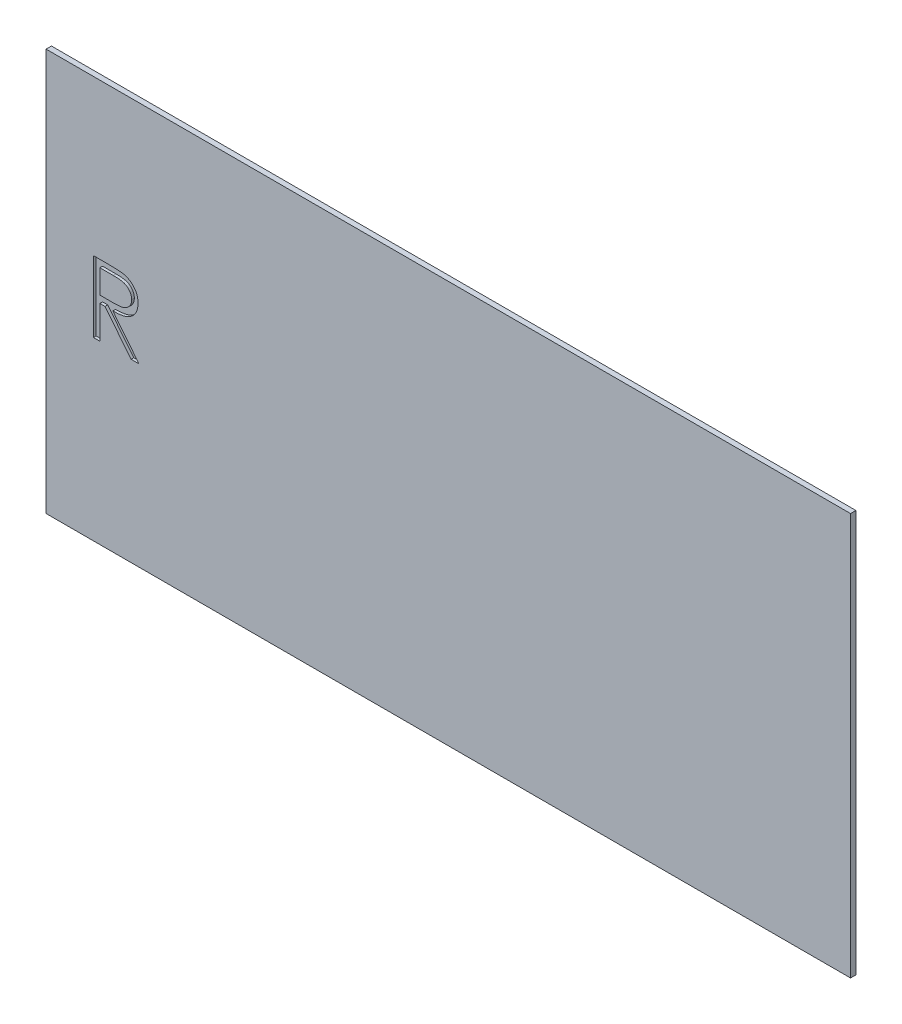
from build123d import *

# Parameters (mm, degrees)
SKETCH1_W           = 1500
SKETCH1_H           = 750
BOSS_EXTRUDE1_DEPTH = 10
CUT_EXTRUDE1_DEPTH  = 5


with BuildPart() as part:
    # Sketch1 → Boss-Extrude1 (new body)
    with BuildSketch(Plane.XY):
        with Locations((750, 375)):
            Rectangle(SKETCH1_W, SKETCH1_H)
    extrude(amount=BOSS_EXTRUDE1_DEPTH)

    # Sketch2 → Cut-Extrude1 (cut)
    with BuildSketch(Plane.XY.offset(10)):
        with BuildLine():
            Line((88.344425578, 460.647477035), (114.818659352, 460.647477035))
            add(Edge.make_bspline(
                [(114.818659352, 460.647477035), (116.585362721, 460.641596255), (119.977628894, 460.630304506), (124.837392387, 460.567342634), (129.253178494, 460.386883356), (133.222678373, 460.231588683), (136.745819201, 459.948411139), (139.833404297, 459.677755727), (142.471213102, 459.323453668), (144.068005696, 458.994409407), (144.790990081, 458.845427088)],
                knots=[0, 0, 0, 0, 1.410062039, 2.707475311, 3.878576406, 4.937260626, 5.877586885, 6.699081471, 7.410979367, 8, 8, 8, 8], degree=3))
            add(Edge.make_bspline(
                [(144.790990081, 458.845427088), (145.758859505, 458.606290421), (147.673951072, 458.133118521), (150.431289877, 457.133008609), (153.058765813, 455.975659702), (155.545464529, 454.616316702), (157.878930446, 453.044889018), (160.083223741, 451.288504629), (162.168346911, 449.356773934), (164.049974004, 447.200992723), (165.824158398, 444.939315125), (167.320514221, 442.493667173), (168.610413901, 439.936222531), (169.637394752, 437.240971919), (170.464330059, 434.434053757), (171.047405178, 431.49004269), (171.397078044, 428.422351072), (171.432677942, 426.329953925), (171.450728997, 425.268996466)],
                knots=[0, 0, 0, 0, 1.027469482, 2.033020251, 3.019912614, 3.986113645, 4.951240523, 5.91722682, 6.890402269, 7.87763091, 8.8651537, 9.85103654, 10.82876324, 11.815024772, 12.821070561, 13.842952187, 14.906261191, 16, 16, 16, 16], degree=3))
            add(Edge.make_bspline(
                [(171.450728997, 425.268996466), (171.395204366, 423.506300548), (171.28686143, 420.066824261), (170.276716142, 415.075237375), (168.622067926, 410.418974589), (166.341991228, 406.103898692), (163.43839795, 402.214121323), (159.948740667, 398.797577328), (155.871072614, 395.938568727), (152.075083589, 393.955977597), (148.721898064, 392.686245634), (145.96141273, 391.792847546), (142.950190664, 391.102588739), (139.717083076, 390.484214711), (136.248635383, 390.017350071), (132.55316068, 389.67541034), (128.628023401, 389.461700761), (125.931576435, 389.429874981), (124.544428917, 389.413502676)],
                knots=[0, 0, 0, 0, 1.260483769, 2.459530307, 3.627416485, 4.787058657, 5.939039949, 7.08810263, 8.267026773, 9.491475466, 10.141966685, 10.831826277, 11.566392101, 12.351337768, 13.187381173, 14.07005841, 15.007169909, 16, 16, 16, 16], degree=3))
            Line((124.544428917, 389.413502676), (173.146776005, 328.355810368))
            Line((173.146776005, 328.355810368), (158.465369088, 328.355810368))
            Line((158.465369088, 328.355810368), (109.863021999, 389.413502676))
            Line((109.863021999, 389.413502676), (100.216754638, 389.413502676))
            Line((100.216754638, 389.413502676), (100.216754638, 328.355810368))
            Line((100.216754638, 328.355810368), (88.344425578, 328.355810368))
            Line((88.344425578, 328.355810368), (88.344425578, 460.647477035))
        make_face()
        with BuildLine():
            Line((100.216754638, 447.079100967), (100.216754638, 402.981878744))
            Line((100.216754638, 402.981878744), (124.438425979, 402.796373603))
            add(Edge.make_bspline(
                [(124.438425979, 402.796373603), (125.569332212, 402.795873289), (127.761350591, 402.794903538), (130.932595957, 402.945858771), (133.885350179, 403.117585383), (136.608319085, 403.380254098), (139.102719105, 403.718772285), (141.367303474, 404.142218416), (143.405768828, 404.635555308), (145.783183822, 405.399128664), (148.437957478, 406.60887995), (151.323104919, 408.36894493), (153.780038519, 410.582718184), (155.855802957, 413.114155362), (157.523790397, 415.897430244), (158.699751974, 418.899179913), (159.445969287, 422.043624243), (159.533982761, 424.204820581), (159.578399937, 425.295497201)],
                knots=[0, 0, 0, 0, 1.146690395, 2.22261258, 3.21895312, 4.145990853, 4.996080663, 5.770904154, 6.481378293, 7.121626537, 8.300444488, 9.431385265, 10.535395872, 11.636531494, 12.74115979, 13.810798291, 14.895190096, 16, 16, 16, 16], degree=3))
            add(Edge.make_bspline(
                [(159.578399937, 425.295497201), (159.532962622, 426.359370672), (159.442922444, 428.467579693), (158.7078053, 431.553978683), (157.464664993, 434.466925906), (155.789389928, 437.194571618), (153.74835044, 439.670532467), (151.355087877, 441.788981407), (148.675040322, 443.537101054), (146.170146813, 444.65418627), (143.931234615, 445.33907358), (141.987315917, 445.821037213), (139.790840419, 446.208253746), (137.331143025, 446.518498905), (134.618724243, 446.785159), (131.639869276, 446.964764919), (128.414342165, 447.071122283), (126.178728992, 447.076379511), (125.021442138, 447.079100967)],
                knots=[0, 0, 0, 0, 1.101028733, 2.181837193, 3.264309656, 4.369019818, 5.486613113, 6.575447106, 7.666700264, 8.788928104, 9.402425223, 10.0903467, 10.862060571, 11.710948788, 12.657782767, 13.684531032, 14.801375019, 16, 16, 16, 16], degree=3))
            Line((125.021442138, 447.079100967), (100.216754638, 447.079100967))
        make_face(mode=Mode.SUBTRACT)
    extrude(amount=-CUT_EXTRUDE1_DEPTH, mode=Mode.SUBTRACT)


solid = part.part
